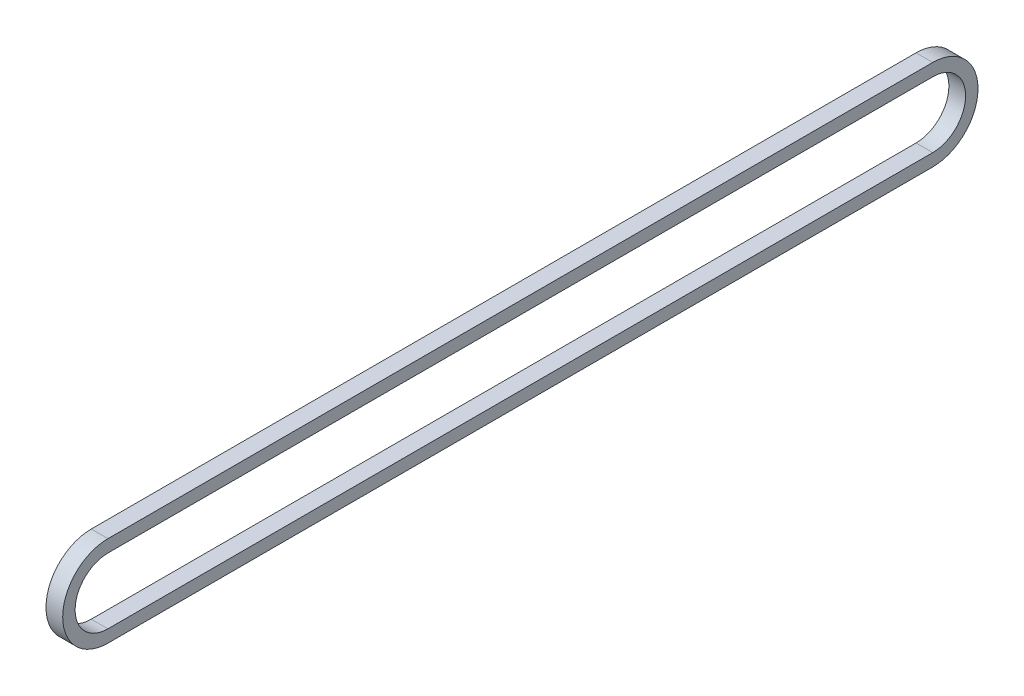
from build123d import *

# Parameters (mm, degrees)
BOSS_EXTRUDE1_DEPTH = 3.8862


with BuildPart() as part:
    # Sketch1 → Boss-Extrude1 (new, symmetric)
    with BuildSketch(Plane(origin=(0, 0, 0), x_dir=(0, 0, -1), z_dir=(1, 0, 0))):
        with BuildLine():
            Line((0, 21.082), (384.172599954, 21.082))
            ThreePointArc((384.172599954, 21.082), (405.254599954, 0), (384.172599954, -21.082))
            Line((384.172599954, -21.082), (0, -21.082))
            ThreePointArc((0, -21.082), (-21.082, 0), (0, 21.082))
        make_face()
        with BuildLine():
            Line((0, 15.2908), (384.172599954, 15.2908))
            ThreePointArc((384.172599954, 15.2908), (399.463399954, 0), (384.172599954, -15.2908))
            Line((384.172599954, -15.2908), (0, -15.2908))
            ThreePointArc((0, -15.2908), (-15.2908, 0), (0, 15.2908))
        make_face(mode=Mode.SUBTRACT)
    extrude(amount=BOSS_EXTRUDE1_DEPTH, both=True)


solid = part.part
